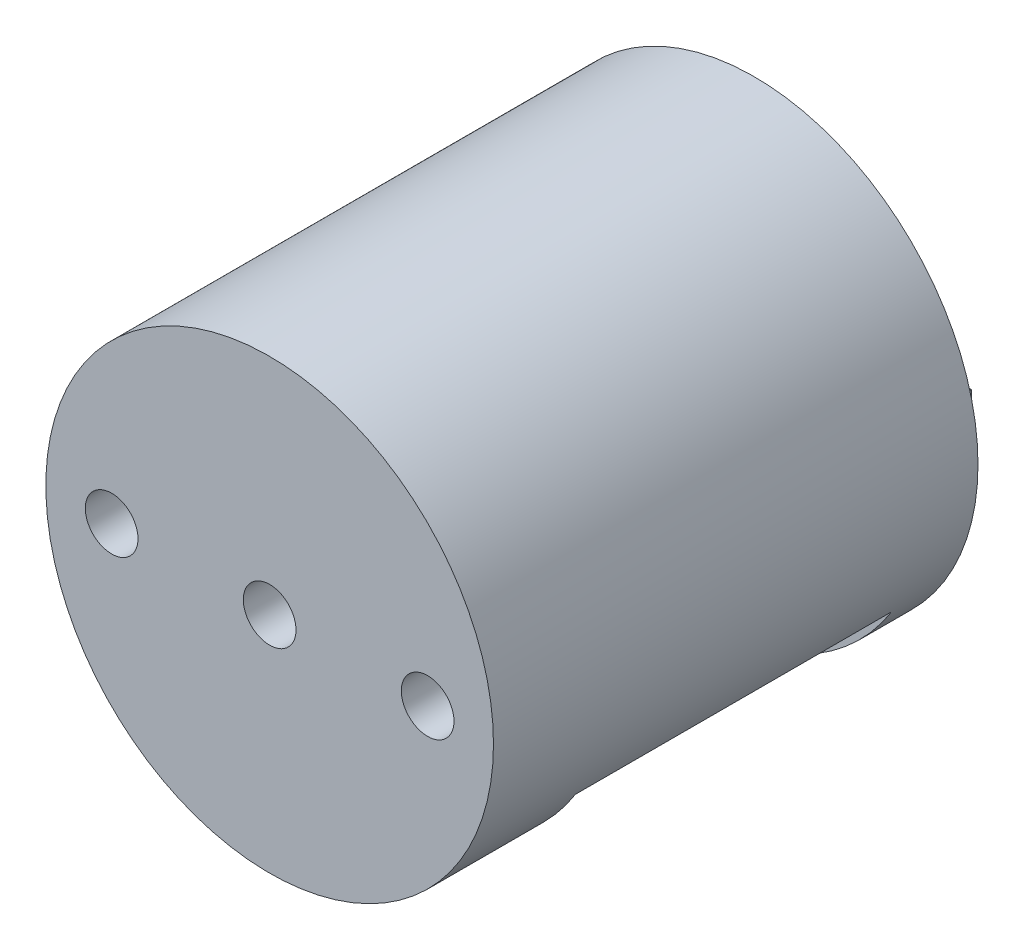
from build123d import *

# Parameters (mm, degrees)
ESQUISSE1_R                  = 8.5
BOSS_EXTRU_1_DEPTH           = 18.4
ESQUISSE2_W                  = 6.4
ESQUISSE2_H                  = 3.4
BOSS_EXTRU_2_DEPTH           = 2.6
ESQUISSE3_W                  = 0.5
ESQUISSE3_H                  = 0.5
BOSS_EXTRU_3_DEPTH           = 3
CHANFREIN1_SIZE              = 0.1
ESQUISSE4_W                  = 12
ESQUISSE4_H                  = 4
ENL_V_MAT_EXTRU_1_DEPTH      = 27.453922204
ESQUISSE5_R                  = 1
ENL_V_MAT_EXTRU_2_DEPTH      = 5
ENL_V_MAT_EXTRU_3_DEPTH      = 12.5
ENL_V_MAT_EXTRU_3_DEPTH_BACK = 0.5
ESQUISSE6_R                  = 6.493106385
ESQUISSE7_R                  = 2.5
BOSS_EXTRU_4_DEPTH           = 5
ESQUISSE8_R                  = 6
BOSS_EXTRU_5_DEPTH           = 0.5
ESQUISSE10_R                 = 1
ENL_V_MAT_EXTRU_4_DEPTH      = 10


with BuildPart() as part:
    # Esquisse1 → Boss.-Extru.1 (new body)
    with BuildSketch(Plane.XY):
        Circle(ESQUISSE1_R)
    extrude(amount=BOSS_EXTRU_1_DEPTH)

    # Esquisse2 → Boss.-Extru.2 (add)
    with BuildSketch(Plane(origin=(0, 0, 0), x_dir=(-1, 0, 0), z_dir=(0, 0, -1))):
        with Locations((0, -4.3)):
            Rectangle(ESQUISSE2_W, ESQUISSE2_H)
    extrude(amount=BOSS_EXTRU_2_DEPTH)

    # Esquisse3 → Boss.-Extru.3 (add)
    with BuildSketch(Plane(origin=(0, 0, -2.6), x_dir=(-1, 0, 0), z_dir=(0, 0, -1))):
        with Locations((-1.23, -3.415159268)):
            Rectangle(ESQUISSE3_W, ESQUISSE3_H)
        with Locations((-2.5, -3.415159268)):
            Rectangle(ESQUISSE3_W, ESQUISSE3_H)
        with Locations((0.04, -3.415159268)):
            Rectangle(ESQUISSE3_W, ESQUISSE3_H)
        with Locations((1.31, -3.415159268)):
            Rectangle(ESQUISSE3_W, ESQUISSE3_H)
        with Locations((2.58, -3.415159268)):
            Rectangle(ESQUISSE3_W, ESQUISSE3_H)
        with Locations((-2.5, -4.685159268)):
            Rectangle(ESQUISSE3_W, ESQUISSE3_H)
        with Locations((-1.23, -4.685159268)):
            Rectangle(ESQUISSE3_W, ESQUISSE3_H)
        with Locations((0.04, -4.685159268)):
            Rectangle(ESQUISSE3_W, ESQUISSE3_H)
        with Locations((1.31, -4.685159268)):
            Rectangle(ESQUISSE3_W, ESQUISSE3_H)
        with Locations((2.58, -4.685159268)):
            Rectangle(ESQUISSE3_W, ESQUISSE3_H)
    extrude(amount=BOSS_EXTRU_3_DEPTH)

    # Chanfrein1
    chanfrein1_edges = [part.edges().sort_by_distance(p)[0] for p in [
        (-1.06, -4.685159268, -5.6),
        (-1.31, -4.935159268, -5.6),
        (-1.56, -4.685159268, -5.6),
        (-1.31, -4.435159268, -5.6),
        (-2.33, -4.685159268, -5.6),
        (-2.58, -4.935159268, -5.6),
        (-2.83, -4.685159268, -5.6),
        (-2.58, -4.435159268, -5.6),
        (2.75, -3.415159268, -5.6),
        (2.5, -3.665159268, -5.6),
        (2.25, -3.415159268, -5.6),
        (2.5, -3.165159268, -5.6),
        (1.48, -3.415159268, -5.6),
        (1.23, -3.665159268, -5.6),
        (0.98, -3.415159268, -5.6),
        (1.23, -3.165159268, -5.6),
        (0.21, -3.415159268, -5.6),
        (-0.04, -3.665159268, -5.6),
        (-0.29, -3.415159268, -5.6),
        (-0.04, -3.165159268, -5.6),
        (-1.06, -3.415159268, -5.6),
        (-1.31, -3.665159268, -5.6),
        (-1.56, -3.415159268, -5.6),
        (-1.31, -3.165159268, -5.6),
        (-2.33, -3.415159268, -5.6),
        (-2.58, -3.665159268, -5.6),
        (-2.83, -3.415159268, -5.6),
        (-2.58, -3.165159268, -5.6),
        (2.75, -4.685159268, -5.6),
        (2.5, -4.935159268, -5.6),
        (2.25, -4.685159268, -5.6),
        (2.5, -4.435159268, -5.6),
        (1.48, -4.685159268, -5.6),
        (1.23, -4.935159268, -5.6),
        (0.98, -4.685159268, -5.6),
        (1.23, -4.435159268, -5.6),
        (0.21, -4.685159268, -5.6),
        (-0.04, -4.935159268, -5.6),
        (-0.29, -4.685159268, -5.6),
        (-0.04, -4.435159268, -5.6),
    ]]
    chamfer(chanfrein1_edges, length=CHANFREIN1_SIZE)

    # Esquisse4 → Enlèv. mat.-Extru.1 (cut, through all)
    with BuildSketch(Plane(origin=(8.5, 0, 0), x_dir=(0, 0, -1), z_dir=(1, 0, 0))):
        with Locations((-8, -6.5)):
            Rectangle(ESQUISSE4_W, ESQUISSE4_H)
    extrude(amount=-ENL_V_MAT_EXTRU_1_DEPTH, mode=Mode.SUBTRACT)

    # Esquisse5 → Enlèv. mat.-Extru.2 (cut)
    with BuildSketch(Plane.XY.offset(18.4)):
        with Locations((-6, 0)):
            Circle(ESQUISSE5_R)
        with Locations((6, 0)):
            Circle(ESQUISSE5_R)
    extrude(amount=-ENL_V_MAT_EXTRU_2_DEPTH, mode=Mode.SUBTRACT)

    # Esquisse6 → Enlèv. mat.-Extru.3 (cut, two sides: drawn at the far end of the back side and taken through both)
    with BuildSketch(Plane.XY.offset(2).offset(-ENL_V_MAT_EXTRU_3_DEPTH_BACK)):
        Circle(ESQUISSE6_R)
    extrude(amount=ENL_V_MAT_EXTRU_3_DEPTH + ENL_V_MAT_EXTRU_3_DEPTH_BACK, mode=Mode.SUBTRACT)

    # Esquisse7 → Boss.-Extru.4 (add)
    with BuildSketch(Plane.XY.offset(1.5)):
        Circle(ESQUISSE7_R)
    extrude(amount=BOSS_EXTRU_4_DEPTH)

    # Esquisse8 → Boss.-Extru.5 (add)
    with BuildSketch(Plane.XY.offset(6.5)):
        Circle(ESQUISSE8_R)
    extrude(amount=BOSS_EXTRU_5_DEPTH)

    # Esquisse10 → Enlèv. mat.-Extru.4 (cut)
    with BuildSketch(Plane.XY.offset(18.4)):
        Circle(ESQUISSE10_R)
    extrude(amount=-ENL_V_MAT_EXTRU_4_DEPTH, mode=Mode.SUBTRACT)


solid = part.part
